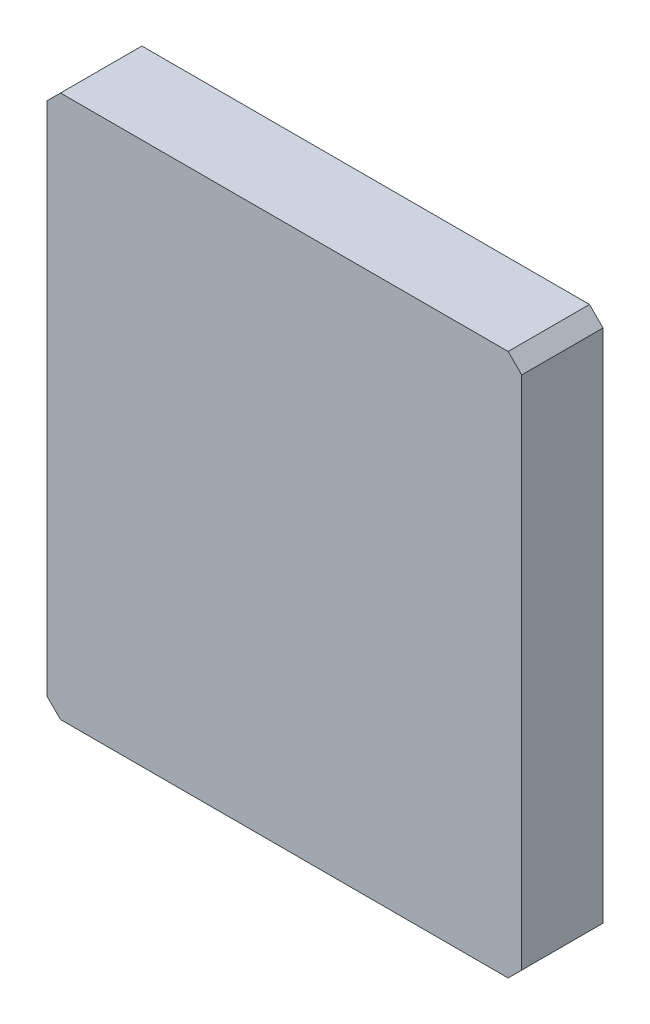
from build123d import *

# Parameters (mm, degrees)
SCHIZZO1_W                   = 17.5
SCHIZZO1_H                   = 20
ESTRUSIONE_ESTRUSIONE1_DEPTH = 3
SMUSSO1_SIZE                 = 0.5
SMUSSO2_SIZE                 = 0.5
SMUSSO3_SIZE                 = 0.5
SMUSSO4_SIZE                 = 0.5


with BuildPart() as part:
    # Schizzo1 → Estrusione-Estrusione1 (new body)
    with BuildSketch(Plane.XY):
        Rectangle(SCHIZZO1_W, SCHIZZO1_H)
    extrude(amount=-ESTRUSIONE_ESTRUSIONE1_DEPTH)

    # Smusso1
    smusso1_edges = [part.edges().sort_by_distance(p)[0] for p in [
        (-8.75, -10, -1.5),
    ]]
    chamfer(smusso1_edges, length=SMUSSO1_SIZE)

    # Smusso2
    smusso2_edges = [part.edges().sort_by_distance(p)[0] for p in [
        (8.75, -10, -1.5),
    ]]
    chamfer(smusso2_edges, length=SMUSSO2_SIZE)

    # Smusso3
    smusso3_edges = [part.edges().sort_by_distance(p)[0] for p in [
        (8.75, 10, -1.5),
    ]]
    chamfer(smusso3_edges, length=SMUSSO3_SIZE)

    # Smusso4
    smusso4_edges = [part.edges().sort_by_distance(p)[0] for p in [
        (-8.75, 10, -1.5),
    ]]
    chamfer(smusso4_edges, length=SMUSSO4_SIZE)


solid = part.part
